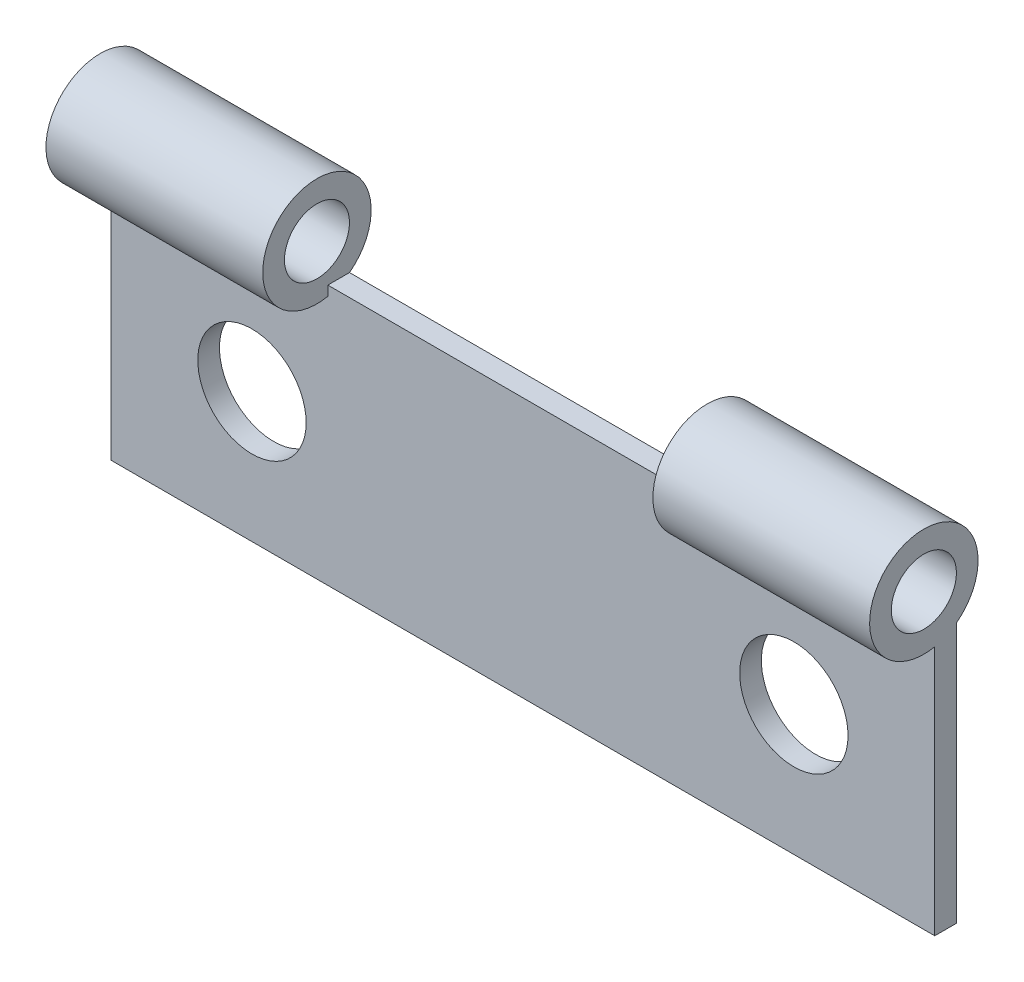
from build123d import *

# Parameters (mm, degrees)
SKETCH_1_W      = 38
SKETCH_1_H      = 12
SKETCH_1_R      = 2.5
EXTRUDE_1_DEPTH = 1
SKETCH_3_R      = 2.50184692
SKETCH_3_R_2    = 1.5
EXTRUDE_4_DEPTH = 10
EXTRUDE_START   = 10
SKETCH_4_R      = 2.50184692
SKETCH_4_R_2    = 1.50184692
EXTRUDE_5_DEPTH = 10


with BuildPart() as part:
    # 草图1 → 凸台-拉伸1 (new body)
    with BuildSketch(Plane.XY):
        Rectangle(SKETCH_1_W, SKETCH_1_H)
        with Locations((12.5, 0)):
            Circle(SKETCH_1_R, mode=Mode.SUBTRACT)
        with Locations((-12.5, 0)):
            Circle(SKETCH_1_R, mode=Mode.SUBTRACT)
    extrude(amount=EXTRUDE_1_DEPTH)

    # 草图3 → 凸台-拉伸4 (add)
    with BuildSketch(Plane.ZY.offset(9)):
        with Locations((1.50184692, 8.00184692)):
            Circle(SKETCH_3_R)
        with Locations((1.50184692, 8.00184692)):
            Circle(SKETCH_3_R_2, mode=Mode.SUBTRACT)
    extrude(amount=EXTRUDE_4_DEPTH)

    # 草图4 → 凸台-拉伸5 (add)
    with BuildSketch(Plane(origin=(9, 0, 0), x_dir=(0, 0, -1), z_dir=(1, 0, 0)).offset(EXTRUDE_START)):
        with Locations((-1.50184692, 8.00184692)):
            Circle(SKETCH_4_R)
        with Locations((-1.50184692, 8.00184692)):
            Circle(SKETCH_4_R_2, mode=Mode.SUBTRACT)
    extrude(amount=-EXTRUDE_5_DEPTH)


solid = part.part
